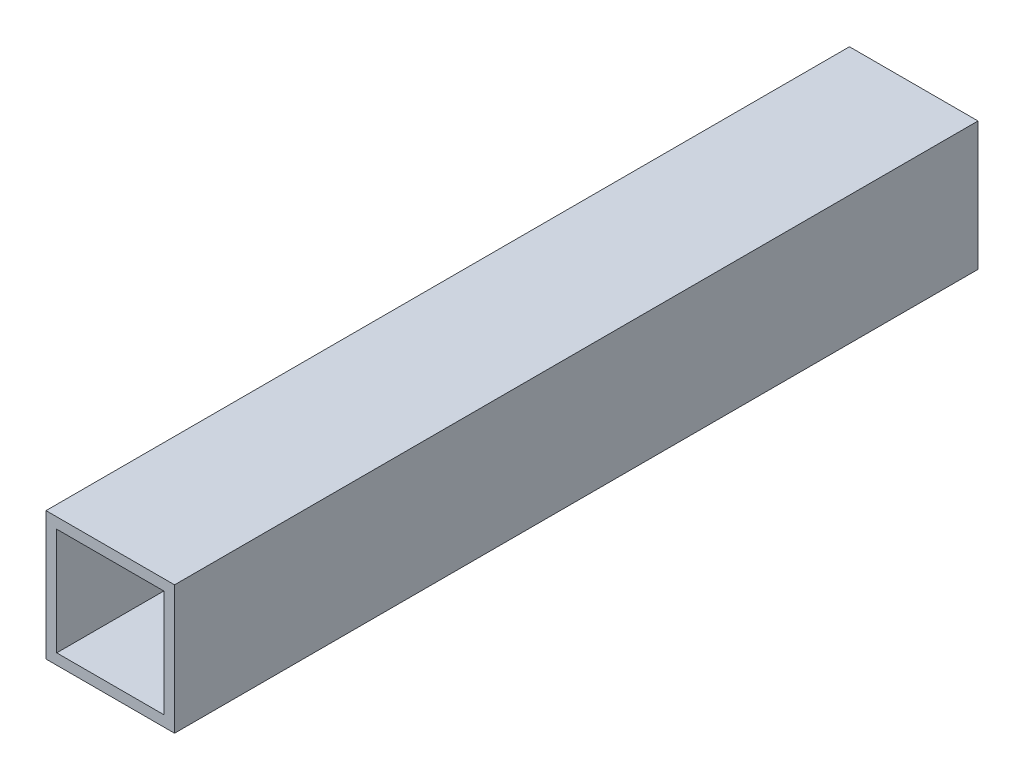
from build123d import *

# Parameters (mm, degrees)
SKETCH_1_W      = 24
SKETCH_1_H      = 24
SKETCH_1_W_2    = 20
SKETCH_1_H_2    = 20
EXTRUDE_1_DEPTH = 75


with BuildPart() as part:
    # 草图1 → 凸台-拉伸1 (new, symmetric)
    with BuildSketch(Plane.XY):
        Rectangle(SKETCH_1_W, SKETCH_1_H)
        Rectangle(SKETCH_1_W_2, SKETCH_1_H_2, mode=Mode.SUBTRACT)
    extrude(amount=EXTRUDE_1_DEPTH, both=True)


solid = part.part
